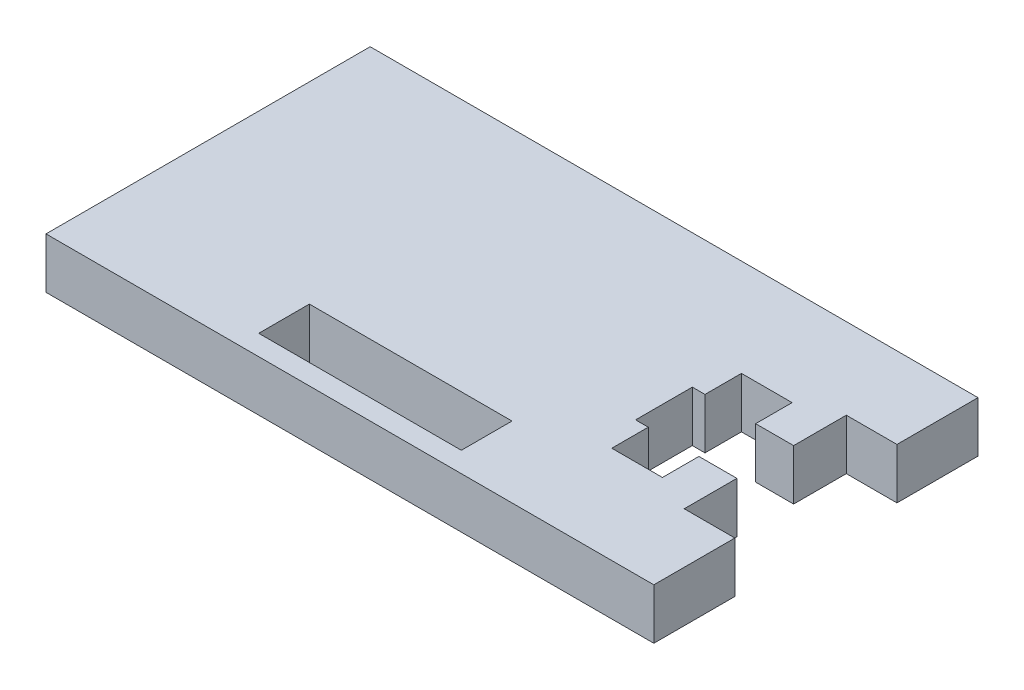
from build123d import *

# Parameters (mm, degrees)
SKETCH1_W           = 38.1
SKETCH1_H           = 20.32
BOSS_EXTRUDE1_DEPTH = 3.175
CUT_EXTRUDE1_DEPTH  = 3.175
SKETCH5_W           = 3.175
SKETCH5_H           = 8.128
CUT_EXTRUDE2_DEPTH  = 3.175
SKETCH6_W           = 12.7
SKETCH6_H           = 3.175
CUT_EXTRUDE3_DEPTH  = 3.175


with BuildPart() as part:
    # Sketch1 → Boss-Extrude1 (new body)
    with BuildSketch(Plane(origin=(0, 0, 0), x_dir=(1, 0, 0), z_dir=(0, 1, 0))):
        with Locations((19.05, -10.16)):
            Rectangle(SKETCH1_W, SKETCH1_H)
    extrude(amount=BOSS_EXTRUDE1_DEPTH)

    # Sketch4 → Cut-Extrude1 (cut)
    with BuildSketch(Plane(origin=(0, 3.175, 0), x_dir=(1, 0, 0), z_dir=(0, 1, 0))):
        Polygon((38.1, -15.24), (38.1, -5.08), (34.925, -5.08), (34.925, -8.382), (28.575, -8.382), (28.575, -11.938), (34.925, -11.938), (34.925, -15.24), align=None)
    extrude(amount=-CUT_EXTRUDE1_DEPTH, mode=Mode.SUBTRACT)

    # Sketch5 → Cut-Extrude2 (cut)
    with BuildSketch(Plane(origin=(0, 3.175, 0), x_dir=(1, 0, 0), z_dir=(0, 1, 0))):
        with Locations((30.95625, -10.16)):
            Rectangle(SKETCH5_W, SKETCH5_H)
    extrude(amount=-CUT_EXTRUDE2_DEPTH, mode=Mode.SUBTRACT)

    # Sketch6 → Cut-Extrude3 (cut)
    with BuildSketch(Plane(origin=(0, 3.175, 0), x_dir=(1, 0, 0), z_dir=(0, 1, 0))):
        with Locations((18.415, -17.4625)):
            Rectangle(SKETCH6_W, SKETCH6_H)
    extrude(amount=-CUT_EXTRUDE3_DEPTH, mode=Mode.SUBTRACT)


solid = part.part
